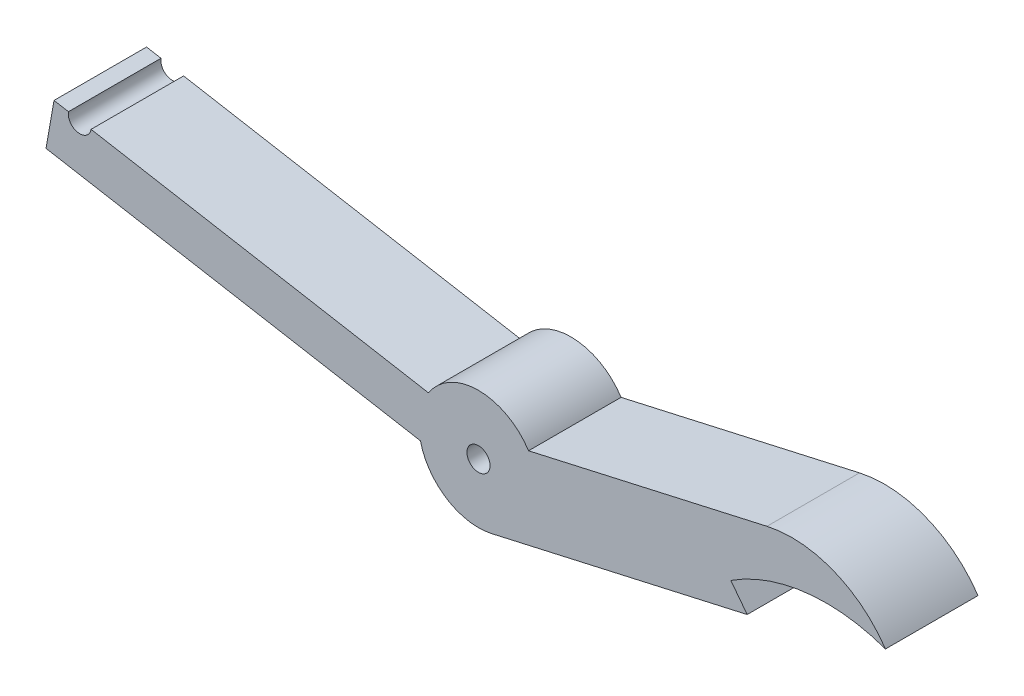
from build123d import *

# Parameters (mm, degrees)
SKETCH1_R           = 1.5875
BOSS_EXTRUDE1_DEPTH = 6.35


with BuildPart() as part:
    # Sketch1 → Boss-Extrude1 (new, symmetric)
    with BuildSketch(Plane.XY):
        with BuildLine():
            Line((-6.857967121, 4.433224129), (-53.17552623, 12.60025948))
            ThreePointArc((-53.17552623, 12.60025948), (-54.999862629, 11.322845381), (-56.277276729, 13.147181781))
            Line((-56.277276729, 13.147181781), (-58.257319182, 13.496316688))
            Line((-58.257319182, 13.496316688), (-59.35998511, 7.242787457))
            Line((-59.35998511, 7.242787457), (-7.960633049, -1.820305103))
            ThreePointArc((-7.960633049, -1.820305103), (-4.365043482, -6.901563925), (1.766856326, -7.9726663))
            Line((1.766856326, -7.9726663), (36.881050722, -0.047144418))
            Line((36.881050722, -0.047144418), (34.635185978, 2.889025961))
            ThreePointArc((34.635185978, 2.889025961), (44.961162175, 6.595254431), (55.860821822, 5.346521684))
            ThreePointArc((55.860821822, 5.346521684), (48.726273767, 11.088641723), (39.595789676, 11.801367988))
            Line((39.595789676, 11.801367988), (6.869791404, 4.414878852))
            ThreePointArc((6.869791404, 4.414878852), (0.010912869, 8.166092708), (-6.857967121, 4.433224129))
        make_face()
        Circle(SKETCH1_R, mode=Mode.SUBTRACT)
    extrude(amount=BOSS_EXTRUDE1_DEPTH, both=True)


solid = part.part
